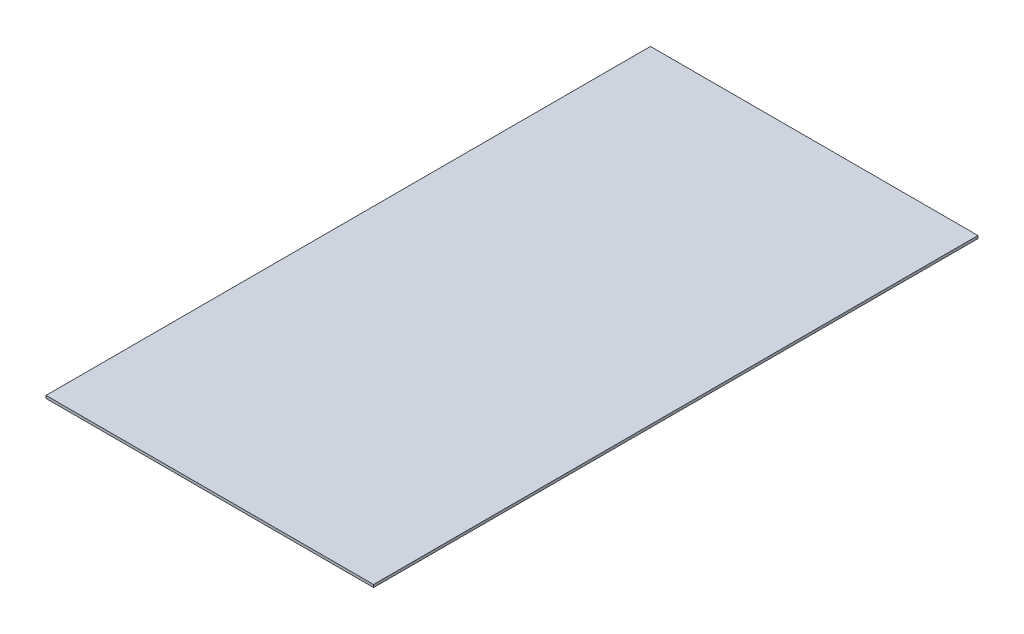
from build123d import *

# Parameters (mm, degrees)
SKETCH1_W           = 22
SKETCH1_H           = 40.6
BOSS_EXTRUDE1_DEPTH = 0.18


with BuildPart() as part:
    # Sketch1 → Boss-Extrude1 (new body)
    with BuildSketch(Plane(origin=(0, 0, 0), x_dir=(1, 0, 0), z_dir=(0, 1, 0))):
        with Locations((11, 20.3)):
            Rectangle(SKETCH1_W, SKETCH1_H)
    extrude(amount=BOSS_EXTRUDE1_DEPTH)


solid = part.part
